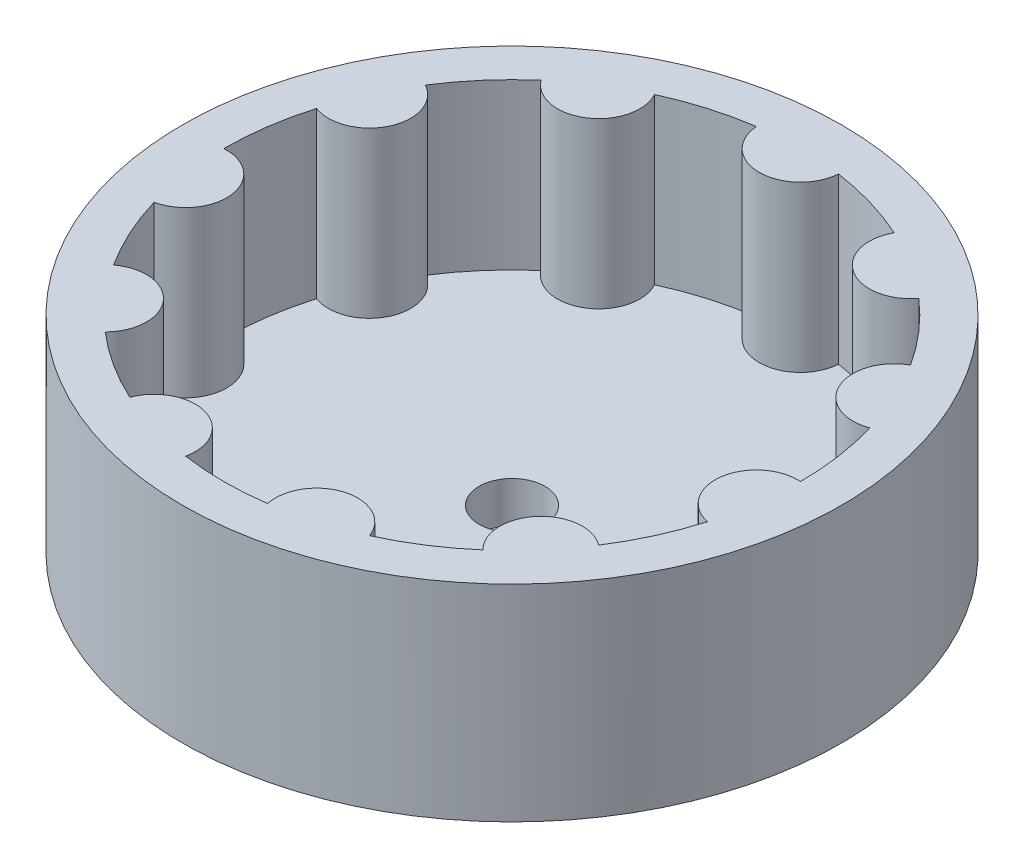
from build123d import *

# Parameters (mm, degrees)
SKETCH1_R              = 5
BOSS_EXTRUDE1_DEPTH    = 20
BOSS_EXTRUDE1_2_DEPTH  = 20
BOSS_EXTRUDE1_3_DEPTH  = 20
BOSS_EXTRUDE1_4_DEPTH  = 20
BOSS_EXTRUDE1_5_DEPTH  = 20
BOSS_EXTRUDE1_6_DEPTH  = 20
BOSS_EXTRUDE1_7_DEPTH  = 20
BOSS_EXTRUDE1_8_DEPTH  = 20
BOSS_EXTRUDE1_9_DEPTH  = 20
BOSS_EXTRUDE1_10_DEPTH = 20
BOSS_EXTRUDE1_11_DEPTH = 20
SKETCH2_R              = 35
SKETCH2_R_2            = 4
BOSS_EXTRUDE2_DEPTH    = 5
SKETCH3_W              = 0.25
SKETCH3_H              = 1.939339828
CUT_EXTRUDE1_DEPTH     = 0.1
BOSS_EXTRUDE4_START    = -5
SKETCH4_R              = 40
SKETCH4_R_2            = 35
BOSS_EXTRUDE4_DEPTH    = 5
BOSS_EXTRUDE5_START    = 20
SKETCH5_R              = 40
SKETCH5_R_2            = 35
BOSS_EXTRUDE5_DEPTH    = 20


with BuildPart() as part:
    # Sketch1 → Boss-Extrude1 (new body)
    with BuildSketch(Plane(origin=(0, 0, 0), x_dir=(1, 0, 0), z_dir=(0, 1, 0))):
        with Locations(Location((0, 35, 0), (0, 0, 270))):
            Circle(SKETCH1_R)
    extrude(amount=BOSS_EXTRUDE1_DEPTH)



with BuildPart() as body_2:
    # Sketch1 → Boss-Extrude1 2 (new body)
    with BuildSketch(Plane(origin=(0, 0, 0), x_dir=(1, 0, 0), z_dir=(0, 1, 0))):
        with Locations(Location((18.922428611, 29.443873649, 0), (0, 0, 270))):
            Circle(SKETCH1_R)
    extrude(amount=BOSS_EXTRUDE1_2_DEPTH)


with BuildPart() as body_3:
    # Sketch1 → Boss-Extrude1 3 (new body)
    with BuildSketch(Plane(origin=(0, 0, 0), x_dir=(1, 0, 0), z_dir=(0, 1, 0))):
        with Locations(Location((31.837119837, 14.539525455, 0), (0, 0, 270))):
            Circle(SKETCH1_R)
    extrude(amount=BOSS_EXTRUDE1_3_DEPTH)


with BuildPart() as body_4:
    # Sketch1 → Boss-Extrude1 4 (new body)
    with BuildSketch(Plane(origin=(0, 0, 0), x_dir=(1, 0, 0), z_dir=(0, 1, 0))):
        with Locations(Location((34.643750466, -4.98101934, 0), (0, 0, 270))):
            Circle(SKETCH1_R)
    extrude(amount=BOSS_EXTRUDE1_4_DEPTH)


with BuildPart() as body_5:
    # Sketch1 → Boss-Extrude1 5 (new body)
    with BuildSketch(Plane(origin=(0, 0, 0), x_dir=(1, 0, 0), z_dir=(0, 1, 0))):
        with Locations(Location((26.451235102, -22.920125688, 0), (0, 0, 270))):
            Circle(SKETCH1_R)
    extrude(amount=BOSS_EXTRUDE1_5_DEPTH)


with BuildPart() as body_6:
    # Sketch1 → Boss-Extrude1 6 (new body)
    with BuildSketch(Plane(origin=(0, 0, 0), x_dir=(1, 0, 0), z_dir=(0, 1, 0))):
        with Locations(Location((9.860639489, -33.582254077, 0), (0, 0, 270))):
            Circle(SKETCH1_R)
    extrude(amount=BOSS_EXTRUDE1_6_DEPTH)


with BuildPart() as body_7:
    # Sketch1 → Boss-Extrude1 7 (new body)
    with BuildSketch(Plane(origin=(0, 0, 0), x_dir=(1, 0, 0), z_dir=(0, 1, 0))):
        with Locations(Location((-9.860639489, -33.582254077, 0), (0, 0, 270))):
            Circle(SKETCH1_R)
    extrude(amount=BOSS_EXTRUDE1_7_DEPTH)


with BuildPart() as body_8:
    # Sketch1 → Boss-Extrude1 8 (new body)
    with BuildSketch(Plane(origin=(0, 0, 0), x_dir=(1, 0, 0), z_dir=(0, 1, 0))):
        with Locations(Location((-26.451235102, -22.920125688, 0), (0, 0, 270))):
            Circle(SKETCH1_R)
    extrude(amount=BOSS_EXTRUDE1_8_DEPTH)


with BuildPart() as body_9:
    # Sketch1 → Boss-Extrude1 9 (new body)
    with BuildSketch(Plane(origin=(0, 0, 0), x_dir=(1, 0, 0), z_dir=(0, 1, 0))):
        with Locations(Location((-34.643750466, -4.98101934, 0), (0, 0, 270))):
            Circle(SKETCH1_R)
    extrude(amount=BOSS_EXTRUDE1_9_DEPTH)


with BuildPart() as body_10:
    # Sketch1 → Boss-Extrude1 10 (new body)
    with BuildSketch(Plane(origin=(0, 0, 0), x_dir=(1, 0, 0), z_dir=(0, 1, 0))):
        with Locations(Location((-31.837119837, 14.539525455, 0), (0, 0, 270))):
            Circle(SKETCH1_R)
    extrude(amount=BOSS_EXTRUDE1_10_DEPTH)


with BuildPart() as body_11:
    # Sketch1 → Boss-Extrude1 11 (new body)
    with BuildSketch(Plane(origin=(0, 0, 0), x_dir=(1, 0, 0), z_dir=(0, 1, 0))):
        with Locations(Location((-18.922428611, 29.443873649, 0), (0, 0, 270))):
            Circle(SKETCH1_R)
    extrude(amount=BOSS_EXTRUDE1_11_DEPTH)


with BuildPart() as part_1:
    add(part.part)

    add(body_2.part)  # Boss-Extrude2 merges body 2

    add(body_3.part)  # Boss-Extrude2 merges body 3

    add(body_4.part)  # Boss-Extrude2 merges body 4

    add(body_5.part)  # Boss-Extrude2 merges body 5

    add(body_6.part)  # Boss-Extrude2 merges body 6

    add(body_7.part)  # Boss-Extrude2 merges body 7

    add(body_8.part)  # Boss-Extrude2 merges body 8

    add(body_9.part)  # Boss-Extrude2 merges body 9

    add(body_10.part)  # Boss-Extrude2 merges body 10

    add(body_11.part)  # Boss-Extrude2 merges body 11
    # Sketch2 → Boss-Extrude2 (add)
    with BuildSketch(Plane(origin=(0, 0, 0), x_dir=(1, 0, 0), z_dir=(0, 1, 0))):
        with Locations(Location((0, 0, 0), (0, 0, 270))):
            Circle(SKETCH2_R)
        with Locations(Location((0, 0, 0), (0, 0, 270))):
            Circle(SKETCH2_R_2, mode=Mode.SUBTRACT)
    extrude(amount=-BOSS_EXTRUDE2_DEPTH)

    # Sketch3 → Cut-Extrude1 (cut)
    with BuildSketch(Plane(origin=(0, 20, 0), x_dir=(1, 0, 0), z_dir=(0, 1, 0))):
        Polygon((-1.060660172, 36.939339828), (-0.25, 36.939339828), (-0.25, 37.75), align=None)
        Polygon((-0.25, 36.939339828), (0, 36.939339828), (0, 38), (-0.25, 37.75), align=None)
        Polygon((0, 38), (0, 36.939339828), (0.25, 36.939339828), (0.25, 37.75), align=None)
        Polygon((0.25, 37.75), (0.25, 36.939339828), (1.060660172, 36.939339828), align=None)
        with Locations((0.125, 35.969669914)):
            Rectangle(SKETCH3_W, SKETCH3_H)
        with Locations((-0.125, 35.969669914)):
            Rectangle(SKETCH3_W, SKETCH3_H)
    extrude(amount=-CUT_EXTRUDE1_DEPTH, mode=Mode.SUBTRACT)

    # Sketch4 → Boss-Extrude4 (add)
    with BuildSketch(Plane.XZ.offset(5).offset(BOSS_EXTRUDE4_START)):
        with Locations(Location((0, 0, 0), (0, 0, 270))):
            Circle(SKETCH4_R)
        Circle(SKETCH4_R_2, mode=Mode.SUBTRACT)
    extrude(amount=BOSS_EXTRUDE4_DEPTH)

    # Sketch5 → Boss-Extrude5 (add)
    with BuildSketch(Plane(origin=(0, 0, 0), x_dir=(1, 0, 0), z_dir=(0, 1, 0)).offset(BOSS_EXTRUDE5_START)):
        with Locations(Location((0, 0, 0), (0, 0, 90))):
            Circle(SKETCH5_R)
        Circle(SKETCH5_R_2, mode=Mode.SUBTRACT)
    extrude(amount=-BOSS_EXTRUDE5_DEPTH)


solid = part_1.part
